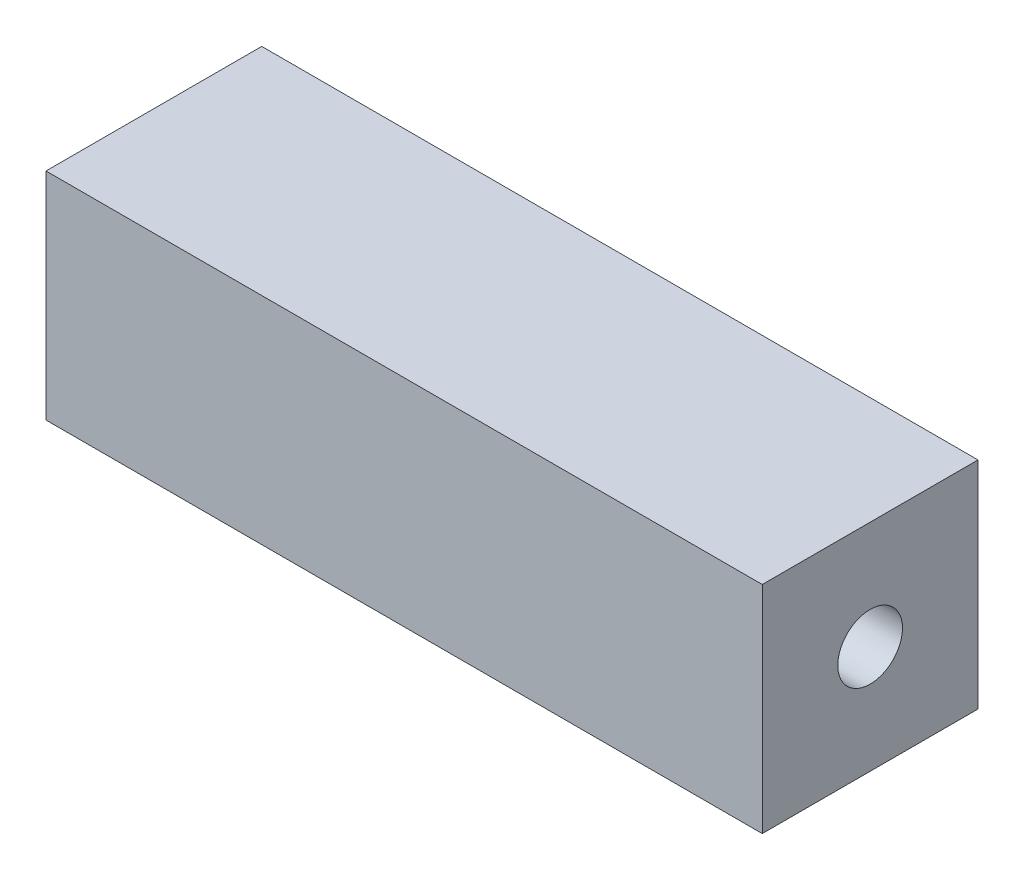
from build123d import *

# Parameters (mm, degrees)
SKETCH_2_W               = 33.2
SKETCH_2_H               = 10
EXTRUDE_1_DEPTH          = 5
CUT_EXTRUDE_1_DEPTH      = 19.043281298
CUT_EXTRUDE_1_DEPTH_BACK = 19.043281298
SKETCH_3_R               = 1.5


with BuildPart() as part:
    # ｽｹｯﾁ2 → ﾎﾞｽ - 押し出し1 (new, symmetric)
    with BuildSketch(Plane(origin=(0, 0, 0), x_dir=(1, 0, 0), z_dir=(0, 1, 0))):
        Rectangle(SKETCH_2_W, SKETCH_2_H)
    extrude(amount=EXTRUDE_1_DEPTH, both=True)

    # ｽｹｯﾁ3 → ｶｯﾄ - 押し出し1 (cut, two sides: drawn at the far end of the back side and taken through both)
    with BuildSketch(Plane(origin=(0, 0, 0), x_dir=(0, 0, -1), z_dir=(1, 0, 0)).offset(-CUT_EXTRUDE_1_DEPTH_BACK)):
        Circle(SKETCH_3_R)
    extrude(amount=CUT_EXTRUDE_1_DEPTH + CUT_EXTRUDE_1_DEPTH_BACK, mode=Mode.SUBTRACT)


solid = part.part
